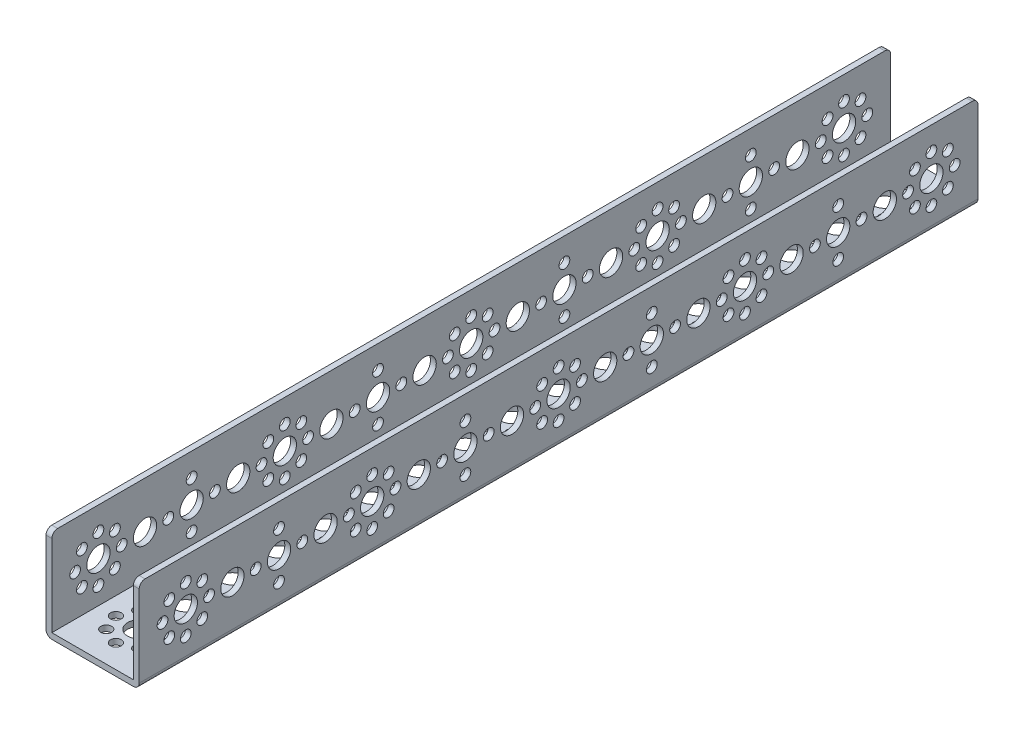
from build123d import *

# Parameters (mm, degrees)
BOSS_EXTRUDE1_DEPTH = 144
SKETCH2_R           = 4
SKETCH2_R_2         = 1.85
CUT_EXTRUDE1_DEPTH  = 151.943698113
SKETCH5_R           = 4
SKETCH5_R_2         = 1.85
CUT_EXTRUDE2_DEPTH  = 2
FILLET1_R           = 2


with BuildPart() as part:
    # Sketch1 → Boss-Extrude1 (new, symmetric)
    with BuildSketch(Plane.XY):
        with BuildLine():
            Line((-14, 0), (14, 0))
            ThreePointArc((14, 0), (15.414213562, 0.585786438), (16, 2))
            Line((16, 2), (16, 32))
            Line((16, 32), (14, 32))
            Line((14, 32), (14, 2))
            Line((14, 2), (-14, 2))
            Line((-14, 2), (-14, 32))
            Line((-14, 32), (-16, 32))
            Line((-16, 32), (-16, 2))
            ThreePointArc((-16, 2), (-15.414213562, 0.585786438), (-14, 0))
        make_face()
    extrude(amount=BOSS_EXTRUDE1_DEPTH, both=True)

    # Sketch2 → Cut-Extrude1 (cut, through all)
    with BuildSketch(Plane(origin=(16, 0, 0), x_dir=(0, 0, -1), z_dir=(1, 0, 0))):
        with Locations((-96, 16)):
            Circle(SKETCH2_R)
        with Locations((-88, 16)):
            Circle(SKETCH2_R_2)
        with Locations((-104, 16)):
            Circle(SKETCH2_R_2)
        with Locations((-96, 8)):
            Circle(SKETCH2_R_2)
        with Locations((-96, 24)):
            Circle(SKETCH2_R_2)
        with Locations((-112, 16)):
            Circle(SKETCH2_R)
        with Locations((-80, 16)):
            Circle(SKETCH2_R)
        with Locations((-48, 16)):
            Circle(SKETCH2_R)
        with Locations((-16, 16)):
            Circle(SKETCH2_R)
        with Locations((-122.343145751, 21.656854249)):
            Circle(SKETCH2_R_2)
        with Locations((-128, 24)):
            Circle(SKETCH2_R_2)
        with Locations((-133.656854249, 21.656854249)):
            Circle(SKETCH2_R_2)
        with Locations((-128, 16)):
            Circle(SKETCH2_R)
        with Locations((-120, 16)):
            Circle(SKETCH2_R_2)
        with Locations((-136, 16)):
            Circle(SKETCH2_R_2)
        with Locations((-128, 8)):
            Circle(SKETCH2_R_2)
        with Locations((-122.343145751, 10.343145751)):
            Circle(SKETCH2_R_2)
        with Locations((-133.656854249, 10.343145751)):
            Circle(SKETCH2_R_2)
        with Locations((-32, 16)):
            Circle(SKETCH2_R)
        with Locations((-24, 16)):
            Circle(SKETCH2_R_2)
        with Locations((-40, 16)):
            Circle(SKETCH2_R_2)
        with Locations((-32, 8)):
            Circle(SKETCH2_R_2)
        with Locations((-32, 24)):
            Circle(SKETCH2_R_2)
        with Locations((-64, 16)):
            Circle(SKETCH2_R)
        with Locations((-56, 16)):
            Circle(SKETCH2_R_2)
        with Locations((-72, 16)):
            Circle(SKETCH2_R_2)
        with Locations((-64, 8)):
            Circle(SKETCH2_R_2)
        with Locations((-64, 24)):
            Circle(SKETCH2_R_2)
        with Locations((-69.656854249, 21.656854249)):
            Circle(SKETCH2_R_2)
        with Locations((-58.343145751, 21.656854249)):
            Circle(SKETCH2_R_2)
        with Locations((-58.343145751, 10.343145751)):
            Circle(SKETCH2_R_2)
        with Locations((-69.656854249, 10.343145751)):
            Circle(SKETCH2_R_2)
        with Locations((8, 16)):
            Circle(SKETCH2_R_2)
        with Locations((0, 8)):
            Circle(SKETCH2_R_2)
        with Locations((0, 16)):
            Circle(SKETCH2_R)
        with Locations((0, 24)):
            Circle(SKETCH2_R_2)
        with Locations((-5.656854249, 21.656854249)):
            Circle(SKETCH2_R_2)
        with Locations((-5.656854249, 10.343145751)):
            Circle(SKETCH2_R_2)
        with Locations((-8, 16)):
            Circle(SKETCH2_R_2)
        with Locations((5.656854249, 21.656854249)):
            Circle(SKETCH2_R_2)
        with Locations((5.656854249, 10.343145751)):
            Circle(SKETCH2_R_2)
    cut_extrude1 = extrude(amount=-CUT_EXTRUDE1_DEPTH, mode=Mode.SUBTRACT)

    # Sketch5 → Cut-Extrude2 (cut)
    with BuildSketch(Plane.XZ):
        with Locations(Location((0, 112, 0), (0, 0, 270))):
            Circle(SKETCH5_R)
        with Locations(Location((0, 80, 0), (0, 0, 270))):
            Circle(SKETCH5_R)
        with Locations(Location((0, 48, 0), (0, 0, 270))):
            Circle(SKETCH5_R)
        with Locations(Location((0, 16, 0), (0, 0, 270))):
            Circle(SKETCH5_R)
        with Locations(Location((0, 96, 0), (0, 0, 270))):
            Circle(SKETCH5_R)
        with Locations(Location((0, 88, 0), (0, 0, 270))):
            Circle(SKETCH5_R_2)
        with Locations(Location((0, 104, 0), (0, 0, 270))):
            Circle(SKETCH5_R_2)
        with Locations(Location((-8, 96, 0), (0, 0, 270))):
            Circle(SKETCH5_R_2)
        with Locations(Location((8, 96, 0), (0, 0, 270))):
            Circle(SKETCH5_R_2)
        with Locations(Location((0, 120, 0), (0, 0, 270))):
            Circle(SKETCH5_R_2)
        with Locations(Location((-8, 128, 0), (0, 0, 270))):
            Circle(SKETCH5_R_2)
        with Locations(Location((0, 128, 0), (0, 0, 270))):
            Circle(SKETCH5_R)
        with Locations(Location((8, 128, 0), (0, 0, 270))):
            Circle(SKETCH5_R_2)
        with Locations(Location((5.656854249, 133.656854249, 0), (0, 0, 270))):
            Circle(SKETCH5_R_2)
        with Locations(Location((-5.656854249, 133.656854249, 0), (0, 0, 270))):
            Circle(SKETCH5_R_2)
        with Locations(Location((0, 136, 0), (0, 0, 270))):
            Circle(SKETCH5_R_2)
        with Locations(Location((5.656854249, 122.343145751, 0), (0, 0, 270))):
            Circle(SKETCH5_R_2)
        with Locations(Location((-5.656854249, 122.343145751, 0), (0, 0, 270))):
            Circle(SKETCH5_R_2)
        with Locations(Location((0, 56, 0), (0, 0, 270))):
            Circle(SKETCH5_R_2)
        with Locations(Location((-8, 64, 0), (0, 0, 270))):
            Circle(SKETCH5_R_2)
        with Locations(Location((0, 64, 0), (0, 0, 270))):
            Circle(SKETCH5_R)
        with Locations(Location((8, 64, 0), (0, 0, 270))):
            Circle(SKETCH5_R_2)
        with Locations(Location((5.656854249, 69.656854249, 0), (0, 0, 270))):
            Circle(SKETCH5_R_2)
        with Locations(Location((-5.656854249, 69.656854249, 0), (0, 0, 270))):
            Circle(SKETCH5_R_2)
        with Locations(Location((0, 72, 0), (0, 0, 270))):
            Circle(SKETCH5_R_2)
        with Locations(Location((5.656854249, 58.343145751, 0), (0, 0, 270))):
            Circle(SKETCH5_R_2)
        with Locations(Location((-5.656854249, 58.343145751, 0), (0, 0, 270))):
            Circle(SKETCH5_R_2)
        with Locations(Location((-8, 0, 0), (0, 0, 270))):
            Circle(SKETCH5_R_2)
        with Locations(Location((0, 8, 0), (0, 0, 270))):
            Circle(SKETCH5_R_2)
        with Locations(Location((0, 0, 0), (0, 0, 270))):
            Circle(SKETCH5_R)
        with Locations(Location((0, -8, 0), (0, 0, 270))):
            Circle(SKETCH5_R_2)
        with Locations(Location((5.656854249, -5.656854249, 0), (0, 0, 270))):
            Circle(SKETCH5_R_2)
        with Locations(Location((5.656854249, 5.656854249, 0), (0, 0, 270))):
            Circle(SKETCH5_R_2)
        with Locations(Location((8, 0, 0), (0, 0, 270))):
            Circle(SKETCH5_R_2)
        with Locations(Location((-5.656854249, -5.656854249, 0), (0, 0, 270))):
            Circle(SKETCH5_R_2)
        with Locations(Location((-5.656854249, 5.656854249, 0), (0, 0, 270))):
            Circle(SKETCH5_R_2)
        with Locations(Location((0, 32, 0), (0, 0, 270))):
            Circle(SKETCH5_R)
        with Locations(Location((8, 32, 0), (0, 0, 270))):
            Circle(SKETCH5_R_2)
        with Locations(Location((-8, 32, 0), (0, 0, 270))):
            Circle(SKETCH5_R_2)
        with Locations(Location((0, 24, 0), (0, 0, 270))):
            Circle(SKETCH5_R_2)
        with Locations(Location((0, 40, 0), (0, 0, 270))):
            Circle(SKETCH5_R_2)
    cut_extrude2 = extrude(amount=-CUT_EXTRUDE2_DEPTH, mode=Mode.SUBTRACT)

    # Fillet1
    fillet1_edges = [part.edges().sort_by_distance(p)[0] for p in [
        (15, 32, 144),
        (15, 32, -144),
        (-15, 32, -144),
        (-15, 32, 144),
    ]]
    fillet(fillet1_edges, radius=FILLET1_R)

    # Mirror1: Cut-Extrude1, Cut-Extrude2 across plane
    add(cut_extrude1.mirror(Plane.XY), mode=Mode.SUBTRACT)
    add(cut_extrude2.mirror(Plane.XY), mode=Mode.SUBTRACT)


solid = part.part
